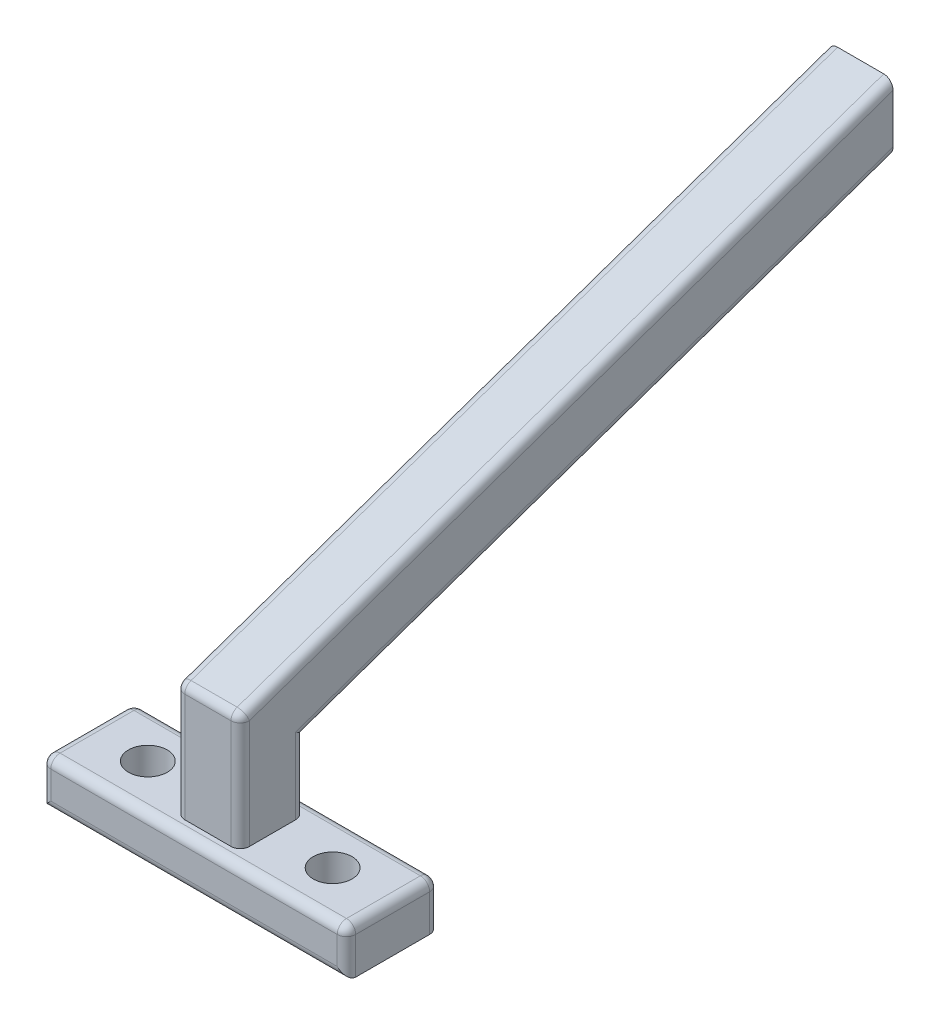
from build123d import *

# Parameters (mm, degrees)
BOSS_EXTRUDE1_DEPTH      = 7
BOSS_EXTRUDE2_DEPTH      = 13
BOSS_EXTRUDE2_DEPTH_BACK = 20
SKETCH2_W                = 5
SKETCH2_H                = 10
SKETCH4_R                = 2.1
CUT_EXTRUDE1_DEPTH       = 78.679302724
FILLET1_R                = 1


with BuildPart() as part:
    # Sketch1 → Boss-Extrude1 (new body)
    with BuildSketch(Plane.YZ):
        Polygon((0, 0), (-5, 0), (-5, 10), (0, 10), (0, 8.5), (12.487376862, 8.5), (36.687835728, -60.999037426), (37.088615702, -62.15), (29.67637193, -62.15), (7.512623138, 1.5), (0, 1.5), align=None)
    extrude(amount=BOSS_EXTRUDE1_DEPTH)

    # Sketch2 → Boss-Extrude2 (add, two sides: drawn at the far end of the back side and taken through both)
    with BuildSketch(Plane.YZ.offset(7).offset(-BOSS_EXTRUDE2_DEPTH_BACK)):
        with Locations((-2.5, 5)):
            Rectangle(SKETCH2_W, SKETCH2_H)
    extrude(amount=BOSS_EXTRUDE2_DEPTH + BOSS_EXTRUDE2_DEPTH_BACK)

    # Sketch4 → Cut-Extrude1 (cut, through all)
    with BuildSketch(Plane.XZ.offset(5)):
        with Locations(Location((-6.5, 5, 0), (0, 0, 270))):
            Circle(SKETCH4_R)
        with Locations(Location((13.5, 5, 0), (0, 0, 270))):
            Circle(SKETCH4_R)
    extrude(amount=-CUT_EXTRUDE1_DEPTH, mode=Mode.SUBTRACT)

    # Fillet1
    fillet1_edges = [part.edges().sort_by_distance(p)[0] for p in [
        (0, 6.243688431, 8.5),
        (0, 24.787996282, -26.825),
        (0, 18.594497534, -30.325),
        (0, 3.756311569, 1.5),
        (3.5, 12.487376862, 8.5),
        (3.5, 0, 0),
        (3.5, -5, 10),
        (3.5, 0, 10),
        (7, 3.756311569, 1.5),
        (7, 18.594497534, -30.325),
        (-13, -2.5, 10),
        (7, 24.787996282, -26.825),
        (-13, 0, 5),
        (-13, -2.5, 0),
        (20, -2.5, 0),
        (20, 0, 5),
        (20, -2.5, 10),
        (7, 6.243688431, 8.5),
    ]]
    fillet(fillet1_edges, radius=FILLET1_R)


solid = part.part
